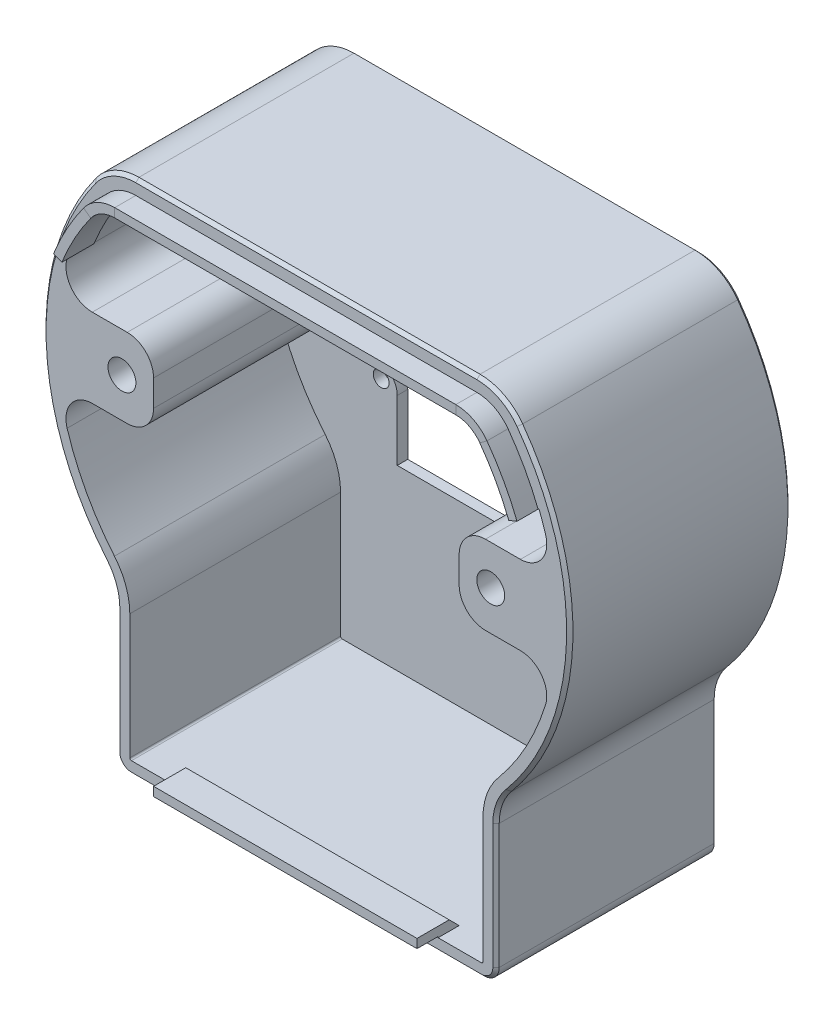
from build123d import *

# Parameters (mm, degrees)
LINEAR_AUSTRAGEN_D_NN1_DEPTH    = 40
AUFSATZ_LINEAR_START            = 2
AUFSATZ_LINEAR_AUSTRAGEN2_DEPTH = 2
SCHNITT_LINEAR_AUSTRAGEN1_REACH = 94.136
SKIZZE4_R                       = 1.5
AUFSATZ_LINEAR_AUSTRAGEN3_REACH = 122.241
AUFSATZ_LINEAR_START_2          = 29
SKIZZE6_W                       = 40
SKIZZE6_H                       = 15
AUFSATZ_LINEAR_AUSTRAGEN4_REACH = 122.241
AUFSATZ_LINEAR_START_3          = -29
SKIZZE6_2_W                     = 40
SKIZZE6_2_H                     = 15
SCHNITT_LINEAR_AUSTRAGEN2_REACH = 94.136
SKIZZE7_R                       = 2.65
SCHNITT_LINEAR_AUSTRAGEN3_REACH = 99.136
SCHNITT_LINEAR_START            = -5
SKIZZE8_R                       = 4.5
AUFSATZ_LINEAR_AUSTRAGEN6_DEPTH = 25
VERRUNDUNG1_R                   = 5
FASE2_SIZE                      = 0.6


with BuildPart() as part:
    # Skizze1 → Linear-Austragen-Dünn1 (new body)
    with BuildSketch(Plane.XY):
        with BuildLine():
            Line((-33.2, -65), (0, -65))
            Line((0, -65), (33.2, -65))
            ThreePointArc((33.2, -65), (35.179898987, -64.179898987), (36, -62.2))
            Line((36, -62.2), (36, -38.522720569))
            ThreePointArc((36, -38.522720569), (36.601418547, -35.107070313), (38.333333333, -32.10226714))
            ThreePointArc((38.333333333, -32.10226714), (49.970076451, -1.729583607), (40.461208274, 29.375))
            ThreePointArc((40.461208274, 29.375), (36.91044215, 32.409264841), (32.368966619, 33.5))
            Line((32.368966619, 33.5), (0, 33.5))
            Line((0, 33.5), (-32.368966619, 33.5))
            ThreePointArc((-32.368966619, 33.5), (-36.91044215, 32.409264841), (-40.461208274, 29.375))
            ThreePointArc((-40.461208274, 29.375), (-49.970076451, -1.729583607), (-38.333333333, -32.10226714))
            ThreePointArc((-38.333333333, -32.10226714), (-36.601418547, -35.107070313), (-36, -38.522720569))
            Line((-36, -38.522720569), (-36, -62.2))
            ThreePointArc((-36, -62.2), (-35.179898987, -64.179898987), (-33.2, -65))
        make_face()
        with BuildLine():
            Line((-33.2, -62.51), (0, -62.51))
            Line((0, -62.51), (33.2, -62.51))
            ThreePointArc((33.2, -62.51), (33.419203102, -62.419203102), (33.51, -62.2))
            Line((33.51, -62.2), (33.51, -38.522720569))
            ThreePointArc((33.51, -38.522720569), (34.261171765, -34.2565734), (36.424333333, -30.503574237))
            ThreePointArc((36.424333333, -30.503574237), (47.481566644, -1.643450344), (38.446240102, 27.912125))
            ThreePointArc((38.446240102, 27.912125), (35.779614743, 30.190857895), (32.368966619, 31.01))
            Line((32.368966619, 31.01), (0, 31.01))
            Line((0, 31.01), (-32.368966619, 31.01))
            ThreePointArc((-32.368966619, 31.01), (-35.779614743, 30.190857895), (-38.446240102, 27.912125))
            ThreePointArc((-38.446240102, 27.912125), (-47.481566644, -1.643450344), (-36.424333333, -30.503574237))
            ThreePointArc((-36.424333333, -30.503574237), (-34.261171765, -34.2565734), (-33.51, -38.522720569))
            Line((-33.51, -38.522720569), (-33.51, -62.2))
            ThreePointArc((-33.51, -62.2), (-33.419203102, -62.419203102), (-33.2, -62.51))
        make_face(mode=Mode.SUBTRACT)
    extrude(amount=LINEAR_AUSTRAGEN_D_NN1_DEPTH)

    # Skizze3 → Aufsatz-Linear austragen2 (add)
    with BuildSketch(Plane(origin=(0, 0, 0), x_dir=(-1, 0, 0), z_dir=(0, 0, -1)).offset(AUFSATZ_LINEAR_START)):
        with BuildLine():
            Line((36, -38.522720569), (36, -62.2))
            ThreePointArc((36, -62.2), (35.179898987, -64.179898987), (33.2, -65))
            Line((33.2, -65), (-33.2, -65))
            ThreePointArc((-33.2, -65), (-35.179898987, -64.179898987), (-36, -62.2))
            Line((-36, -62.2), (-36, -38.522720569))
            ThreePointArc((-36, -38.522720569), (-36.601418547, -35.107070313), (-38.333333333, -32.10226714))
            ThreePointArc((-38.333333333, -32.10226714), (-49.970076451, -1.729583607), (-40.461208274, 29.375))
            ThreePointArc((-40.461208274, 29.375), (-36.91044215, 32.409264841), (-32.368966619, 33.5))
            Line((-32.368966619, 33.5), (32.368966619, 33.5))
            ThreePointArc((32.368966619, 33.5), (36.91044215, 32.409264841), (40.461208274, 29.375))
            ThreePointArc((40.461208274, 29.375), (49.970076451, -1.729583607), (38.333333333, -32.10226714))
            ThreePointArc((38.333333333, -32.10226714), (36.601418547, -35.107070313), (36, -38.522720569))
        make_face()
        with BuildLine():
            Line((-28.75, 13.25), (-26.75, 13.25))
            ThreePointArc((-26.75, 13.25), (-23.921572875, 14.421572875), (-22.75, 17.25))
            Line((-22.75, 17.25), (-22.75, 28.75))
            Line((-22.75, 28.75), (22.75, 28.75))
            Line((22.75, 28.75), (22.75, 17.25))
            ThreePointArc((22.75, 17.25), (23.921572875, 14.421572875), (26.75, 13.25))
            Line((26.75, 13.25), (28.75, 13.25))
            Line((28.75, 13.25), (28.75, -13.25))
            Line((28.75, -13.25), (26.75, -13.25))
            ThreePointArc((26.75, -13.25), (23.921572875, -14.421572875), (22.75, -17.25))
            Line((22.75, -17.25), (22.75, -28.75))
            Line((22.75, -28.75), (-22.75, -28.75))
            Line((-22.75, -28.75), (-22.75, -17.25))
            ThreePointArc((-22.75, -17.25), (-23.921572875, -14.421572875), (-26.75, -13.25))
            Line((-26.75, -13.25), (-28.75, -13.25))
            Line((-28.75, -13.25), (-28.75, 13.25))
        make_face(mode=Mode.SUBTRACT)
    extrude(amount=-AUFSATZ_LINEAR_AUSTRAGEN2_DEPTH)

    # Skizze4 → Schnitt-Linear austragen1 (cut, up to next)
    with BuildSketch(Plane(origin=(0, 0, -2), x_dir=(-1, 0, 0), z_dir=(0, 0, -1)), mode=Mode.PRIVATE) as schnitt_linear_austragen1_sk1:
        with Locations((-25.8, 16)):
            Circle(SKIZZE4_R)
    schnitt_linear_austragen1_tool1 = extrude(schnitt_linear_austragen1_sk1.sketch, amount=-SCHNITT_LINEAR_AUSTRAGEN1_REACH, mode=Mode.PRIVATE) & part.part
    # Skizze4 → Schnitt-Linear austragen1 (cut, up to next)
    with BuildSketch(Plane(origin=(0, 0, -2), x_dir=(-1, 0, 0), z_dir=(0, 0, -1)), mode=Mode.PRIVATE) as schnitt_linear_austragen1_sk2:
        with Locations((25.8, 16)):
            Circle(SKIZZE4_R)
    schnitt_linear_austragen1_tool2 = extrude(schnitt_linear_austragen1_sk2.sketch, amount=-SCHNITT_LINEAR_AUSTRAGEN1_REACH, mode=Mode.PRIVATE) & part.part
    # Skizze4 → Schnitt-Linear austragen1 (cut, up to next)
    with BuildSketch(Plane(origin=(0, 0, -2), x_dir=(-1, 0, 0), z_dir=(0, 0, -1)), mode=Mode.PRIVATE) as schnitt_linear_austragen1_sk3:
        with Locations((25.8, -16)):
            Circle(SKIZZE4_R)
    schnitt_linear_austragen1_tool3 = extrude(schnitt_linear_austragen1_sk3.sketch, amount=-SCHNITT_LINEAR_AUSTRAGEN1_REACH, mode=Mode.PRIVATE) & part.part
    # Skizze4 → Schnitt-Linear austragen1 (cut, up to next)
    with BuildSketch(Plane(origin=(0, 0, -2), x_dir=(-1, 0, 0), z_dir=(0, 0, -1)), mode=Mode.PRIVATE) as schnitt_linear_austragen1_sk4:
        with Locations((-25.8, -16)):
            Circle(SKIZZE4_R)
    schnitt_linear_austragen1_tool4 = extrude(schnitt_linear_austragen1_sk4.sketch, amount=-SCHNITT_LINEAR_AUSTRAGEN1_REACH, mode=Mode.PRIVATE) & part.part
    add(schnitt_linear_austragen1_tool1.solids().sort_by_distance((25.8, 16, -2))[0], mode=Mode.SUBTRACT)
    add(schnitt_linear_austragen1_tool2.solids().sort_by_distance((-25.8, 16, -2))[0], mode=Mode.SUBTRACT)
    add(schnitt_linear_austragen1_tool3.solids().sort_by_distance((-25.8, -16, -2))[0], mode=Mode.SUBTRACT)
    add(schnitt_linear_austragen1_tool4.solids().sort_by_distance((25.8, -16, -2))[0], mode=Mode.SUBTRACT)

    # Skizze6 → Aufsatz-Linear austragen3 (add, up to next)
    with BuildSketch(Plane(origin=(0, 0, 0), x_dir=(0, 0, -1), z_dir=(1, 0, 0)).offset(AUFSATZ_LINEAR_START_2), mode=Mode.PRIVATE) as aufsatz_linear_austragen3_sk1:
        with Locations((-20, 0)):
            Rectangle(SKIZZE6_W, SKIZZE6_H)
    aufsatz_linear_austragen3_tool1 = extrude(aufsatz_linear_austragen3_sk1.sketch, amount=AUFSATZ_LINEAR_AUSTRAGEN3_REACH, mode=Mode.PRIVATE) - part.part
    add(aufsatz_linear_austragen3_tool1.solids().sort_by_distance((29, 0, 20))[0])

    # Skizze6<2> → Aufsatz-Linear austragen4 (add, up to next)
    with BuildSketch(Plane(origin=(0, 0, 0), x_dir=(0, 0, -1), z_dir=(1, 0, 0)).offset(AUFSATZ_LINEAR_START_3), mode=Mode.PRIVATE) as aufsatz_linear_austragen4_sk1:
        with Locations((-20, 0)):
            Rectangle(SKIZZE6_2_W, SKIZZE6_2_H)
    aufsatz_linear_austragen4_tool1 = extrude(aufsatz_linear_austragen4_sk1.sketch, amount=-AUFSATZ_LINEAR_AUSTRAGEN4_REACH, mode=Mode.PRIVATE) - part.part
    add(aufsatz_linear_austragen4_tool1.solids().sort_by_distance((-29, 0, 20))[0])

    # Skizze7 → Schnitt-Linear austragen2 (cut, up to next)
    with BuildSketch(Plane.XY.offset(40), mode=Mode.PRIVATE) as schnitt_linear_austragen2_sk1:
        with Locations((-35, 0)):
            Circle(SKIZZE7_R)
    schnitt_linear_austragen2_tool1 = extrude(schnitt_linear_austragen2_sk1.sketch, amount=-SCHNITT_LINEAR_AUSTRAGEN2_REACH, mode=Mode.PRIVATE) & part.part
    # Skizze7 → Schnitt-Linear austragen2 (cut, up to next)
    with BuildSketch(Plane.XY.offset(40), mode=Mode.PRIVATE) as schnitt_linear_austragen2_sk2:
        with Locations((35, 0)):
            Circle(SKIZZE7_R)
    schnitt_linear_austragen2_tool2 = extrude(schnitt_linear_austragen2_sk2.sketch, amount=-SCHNITT_LINEAR_AUSTRAGEN2_REACH, mode=Mode.PRIVATE) & part.part
    add(schnitt_linear_austragen2_tool1.solids().sort_by_distance((-35, 0, 40))[0], mode=Mode.SUBTRACT)
    add(schnitt_linear_austragen2_tool2.solids().sort_by_distance((35, 0, 40))[0], mode=Mode.SUBTRACT)

    # Skizze8 → Schnitt-Linear austragen3 (cut, up to next)
    with BuildSketch(Plane.XY.offset(40).offset(SCHNITT_LINEAR_START), mode=Mode.PRIVATE) as schnitt_linear_austragen3_sk1:
        with Locations((-35, 0)):
            Circle(SKIZZE8_R)
    schnitt_linear_austragen3_tool1 = extrude(schnitt_linear_austragen3_sk1.sketch, amount=-SCHNITT_LINEAR_AUSTRAGEN3_REACH, mode=Mode.PRIVATE) & part.part
    # Skizze8 → Schnitt-Linear austragen3 (cut, up to next)
    with BuildSketch(Plane.XY.offset(40).offset(SCHNITT_LINEAR_START), mode=Mode.PRIVATE) as schnitt_linear_austragen3_sk2:
        with Locations((35, 0)):
            Circle(SKIZZE8_R)
    schnitt_linear_austragen3_tool2 = extrude(schnitt_linear_austragen3_sk2.sketch, amount=-SCHNITT_LINEAR_AUSTRAGEN3_REACH, mode=Mode.PRIVATE) & part.part
    add(schnitt_linear_austragen3_tool1.solids().sort_by_distance((-35, 0, 35))[0], mode=Mode.SUBTRACT)
    add(schnitt_linear_austragen3_tool2.solids().sort_by_distance((35, 0, 35))[0], mode=Mode.SUBTRACT)

    # Austragung12: sweep along a path in Skizze10
    with BuildLine(Plane.XY.offset(40)) as austragung12_path:
        ThreePointArc((44.169560786, 17.5), (41.634669758, 22.885680548), (38.446240102, 27.912125))
        ThreePointArc((38.446240102, 27.912125), (35.779614743, 30.190857895), (32.368966619, 31.01))
        Line((32.368966619, 31.01), (-32.368966619, 31.01))
        ThreePointArc((-32.368966619, 31.01), (-35.779614743, 30.190857895), (-38.446240102, 27.912125))
        ThreePointArc((-38.446240102, 27.912125), (-41.634669758, 22.885680548), (-44.169560786, 17.5))
    # Skizze9 → Austragung12 (sweep)
    with BuildSketch(Plane(origin=(0, 0, 0), x_dir=(0, 0, -1), z_dir=(1, 0, 0))):
        Polygon((-40, 31.01), (-40, 30.81), (-44, 30.81), (-44, 29.12), (-37.89, 29.12), (-35, 32.01), (-40, 32.01), align=None)
    sweep(path=austragung12_path.line)

    # Skizze9<4> → Aufsatz-Linear austragen6 (add, symmetric)
    with BuildSketch(Plane(origin=(0, 0, 0), x_dir=(0, 0, -1), z_dir=(1, 0, 0))):
        Polygon((-40, -63.51), (-35, -63.51), (-37.89, -60.62), (-44, -60.62), (-44, -62.31), (-40, -62.31), (-40, -62.51), align=None)
    extrude(amount=AUFSATZ_LINEAR_AUSTRAGEN6_DEPTH, both=True)

    # Verrundung1
    verrundung1_edges = [part.edges().sort_by_distance(p)[0] for p in [
        (29, 7.5, 20),
        (29, -7.5, 20),
        (-29, -7.5, 20),
        (-29, 7.5, 20),
        (46.914284605, 7.5, 20),
        (46.914284605, -7.5, 20),
        (-46.914284605, -7.5, 20),
        (-46.914284605, 7.5, 20),
    ]]
    fillet(verrundung1_edges, radius=VERRUNDUNG1_R)

    # Fase2
    fase2_edges = [part.edges().sort_by_distance(p)[0] for p in [
        (36, -50.361360284, -2),
        (35.179898987, -64.179898987, -2),
        (36.601418547, -35.107070313, -2),
        (0, -65, -2),
        (49.970076451, -1.729583607, -2),
        (-35.179898987, -64.179898987, -2),
        (36.91044215, 32.409264841, -2),
        (-36, -50.361360284, -2),
        (0, 33.5, -2),
        (-36.601418547, -35.107070313, -2),
        (-36.91044215, 32.409264841, -2),
        (-49.970076451, -1.729583607, -2),
        (36, -50.361360284, 40),
        (36.601418547, -35.107070313, 40),
        (35.179898987, -64.179898987, 40),
        (49.970076451, -1.729583607, 40),
        (0, -65, 40),
        (36.91044215, 32.409264841, 40),
        (-35.179898987, -64.179898987, 40),
        (0, 33.5, 40),
        (-36, -50.361360284, 40),
        (-36.91044215, 32.409264841, 40),
        (-36.601418547, -35.107070313, 40),
        (-49.970076451, -1.729583607, 40),
        (-39.5, 0, -2),
        (30.5, 0, -2),
    ]]
    chamfer(fase2_edges, length=FASE2_SIZE)


solid = part.part
